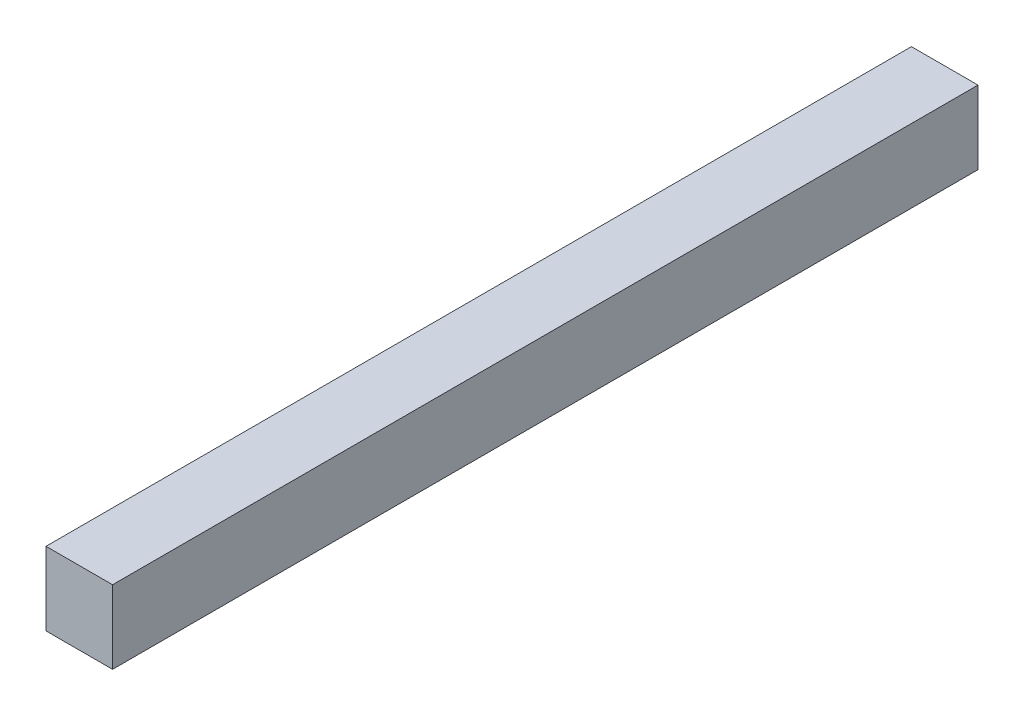
from build123d import *

# Parameters (mm, degrees)
SKETCH2_W           = 20
SKETCH2_H           = 22.02
BOSS_EXTRUDE1_DEPTH = 260


with BuildPart() as part:
    # Sketch2 → Boss-Extrude1 (new body)
    with BuildSketch(Plane.XY):
        Rectangle(SKETCH2_W, SKETCH2_H)
    extrude(amount=BOSS_EXTRUDE1_DEPTH)


solid = part.part
